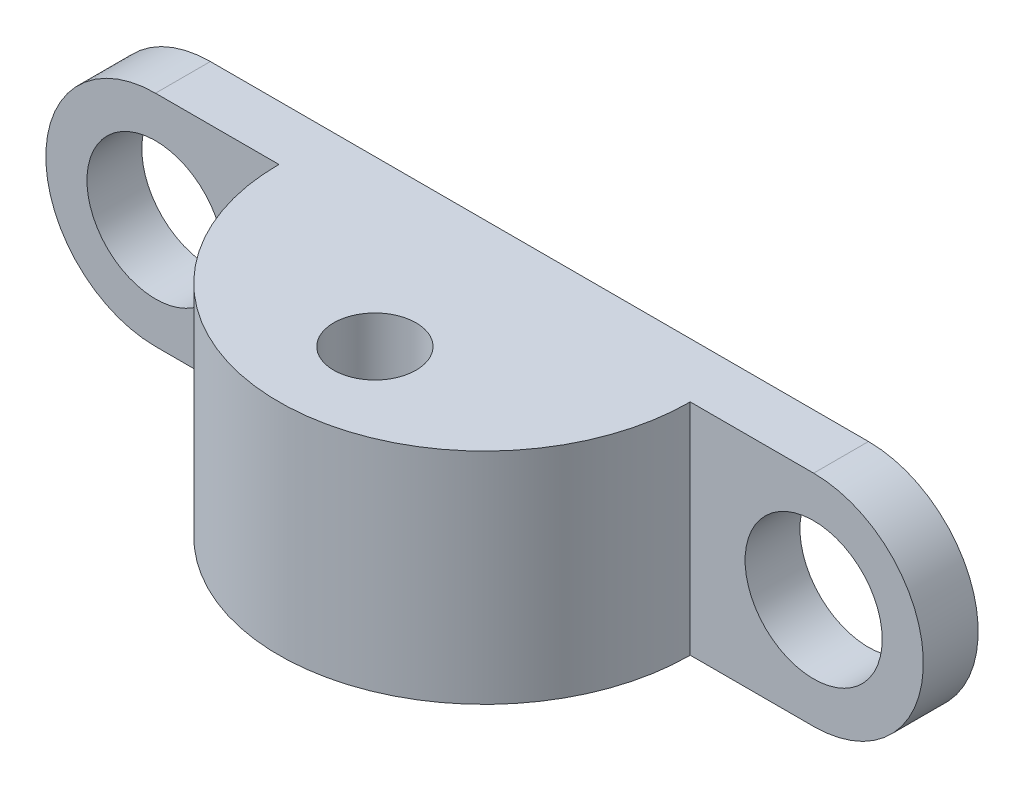
from build123d import *

# Parameters (mm, degrees)
BOSS_EXTRUDE1_DEPTH = 2
SKETCH2_R           = 1.5
BOSS_EXTRUDE2_DEPTH = 8
SKETCH6_R           = 2.5
CUT_EXTRUDE1_DEPTH  = 30.261749777


with BuildPart() as part:
    # Sketch1 → Boss-Extrude1 (new body)
    with BuildSketch(Plane.XY):
        with BuildLine():
            ThreePointArc((4, 0), (2.828427125, 2.828427125), (0, 4))
            Line((0, 4), (0, -4))
            ThreePointArc((0, -4), (2.828427125, -2.828427125), (4, 0))
        make_face()
        with BuildLine():
            Line((0, -4), (0, 4))
            ThreePointArc((0, 4), (-4, 0), (0, -4))
        make_face()
        with BuildLine():
            ThreePointArc((4, 0), (2.828427125, 2.828427125), (0, 4))
            Line((0, 4), (0, -4))
            ThreePointArc((0, -4), (2.828427125, -2.828427125), (4, 0))
        make_face()
        with BuildLine():
            Line((0, -4), (0, 4))
            ThreePointArc((0, 4), (-4, 0), (0, -4))
        make_face()
        with BuildLine():
            Line((24, 4), (0, 4))
            ThreePointArc((0, 4), (2.828427125, 2.828427125), (4, 0))
            ThreePointArc((4, 0), (2.828427125, -2.828427125), (0, -4))
            Line((0, -4), (24, -4))
            ThreePointArc((24, -4), (20, 0), (24, 4))
        make_face()
        with BuildLine():
            ThreePointArc((28, 0), (26.828427125, 2.828427125), (24, 4))
            Line((24, 4), (24, -4))
            ThreePointArc((24, -4), (26.828427125, -2.828427125), (28, 0))
        make_face()
        with BuildLine():
            Line((24, -4), (24, 4))
            ThreePointArc((24, 4), (20, 0), (24, -4))
        make_face()
        with BuildLine():
            ThreePointArc((28, 0), (26.828427125, 2.828427125), (24, 4))
            Line((24, 4), (24, -4))
            ThreePointArc((24, -4), (26.828427125, -2.828427125), (28, 0))
        make_face()
        with BuildLine():
            Line((24, -4), (24, 4))
            ThreePointArc((24, 4), (20, 0), (24, -4))
        make_face()
    extrude(amount=BOSS_EXTRUDE1_DEPTH)

    # Sketch2 → Boss-Extrude2 (add)
    with BuildSketch(Plane.XZ.offset(4)):
        with BuildLine():
            Line((4.5, 2), (19.5, 2))
            ThreePointArc((19.5, 2), (12, 9.5), (4.5, 2))
        make_face()
        with Locations(Location((12, 6, 0), (0, 0, 270))):
            Circle(SKETCH2_R, mode=Mode.SUBTRACT)
    extrude(amount=-BOSS_EXTRUDE2_DEPTH)

    # Sketch6 → Cut-Extrude1 (cut, through all)
    with BuildSketch(Plane.XY.offset(2)):
        Circle(SKETCH6_R)
        with Locations((24, 0)):
            Circle(SKETCH6_R)
    extrude(amount=-CUT_EXTRUDE1_DEPTH, mode=Mode.SUBTRACT)


solid = part.part
